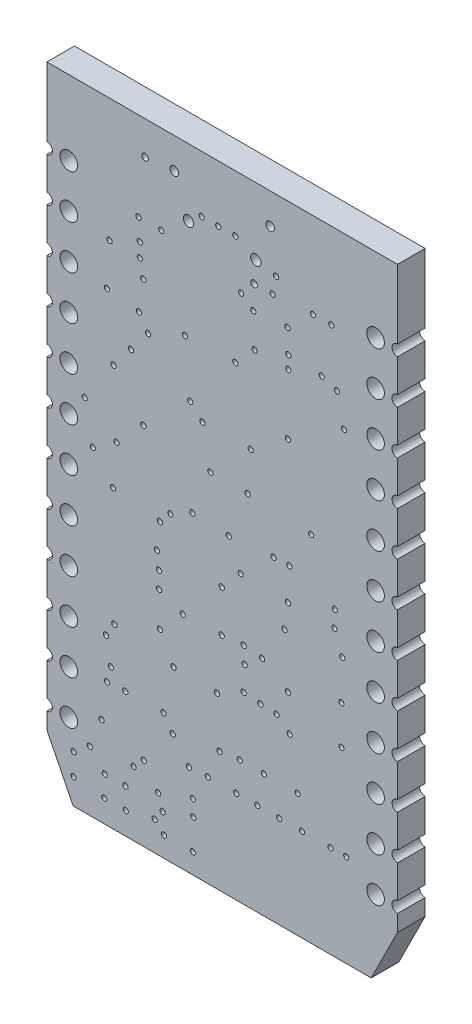
from build123d import *

# Parameters (mm, degrees)
BOARD_OUTLINE_DEPTH = 1.6
SKETCH2_R           = 0.3
SKETCH2_R_2         = 0.1524
SKETCH2_R_3         = 0.15
SKETCH2_R_4         = 0.1905
NPTH_DEPTH          = 42.872021399
SKETCH3_R           = 0.51
SKETCH3_R_2         = 0.32
SKETCH3_R_3         = 0.25
PTH_DEPTH           = 42.872021399


with BuildPart() as part:
    # Sketch1 → Board_Outline (new body)
    with BuildSketch(Plane.XY):
        Polygon((0, 36.576), (0, 3.048), (1.524, 0), (18.796, 0), (20.32, 3.048), (20.32, 36.576), align=None)
    extrude(amount=BOARD_OUTLINE_DEPTH)

    # Sketch2 → NPTH (cut, through all)
    with BuildSketch(Plane.XY):
        with Locations((12.11, 32.698)):
            Circle(SKETCH2_R)
        with Locations((8.21, 32.698)):
            Circle(SKETCH2_R)
        with Locations((13.3096, 10.4902)):
            Circle(SKETCH2_R_2)
        with Locations((17.2212, 26.7462)):
            Circle(SKETCH2_R_2)
        with Locations((4.8768, 24.5872)):
            Circle(SKETCH2_R_2)
        with Locations((16.8142, 28.4788)):
            Circle(SKETCH2_R_2)
        with Locations((9.4742, 20.7264)):
            Circle(SKETCH2_R_2)
        with Locations((13.9954, 28.1432)):
            Circle(SKETCH2_R_2)
        with Locations((11.6332, 20.7264)):
            Circle(SKETCH2_R_2)
        with Locations((10.0076, 6.985)):
            Circle(SKETCH2_R_2)
        with Locations((13.9954, 28.8798)):
            Circle(SKETCH2_R_2)
        with Locations((12.0396, 28.1432)):
            Circle(SKETCH2_R_2)
        with Locations((3.9116, 10.3124)):
            Circle(SKETCH2_R_2)
        with Locations((5.588, 21.1328)):
            Circle(SKETCH2_R_2)
        with Locations((3.429, 9.525)):
            Circle(SKETCH2_R_2)
        with Locations((3.8354, 17.1196)):
            Circle(SKETCH2_R_2)
        with Locations((11.4046, 10.6426)):
            Circle(SKETCH2_R_2)
        with Locations((12.3698, 10.541)):
            Circle(SKETCH2_R_2)
        with Locations((7.874, 12.8016)):
            Circle(SKETCH2_R_2)
        with Locations((6.5532, 16.7894)):
            Circle(SKETCH2_R_2)
        with Locations((10.1346, 15.2908)):
            Circle(SKETCH2_R_2)
        with Locations((11.2268, 16.51)):
            Circle(SKETCH2_R_2)
        with Locations((14.0462, 18.3134)):
            Circle(SKETCH2_R_2)
        with Locations((13.1318, 18.288)):
            Circle(SKETCH2_R_2)
        with Locations((17.1196, 15.2654)):
            Circle(SKETCH2_R_2)
        with Locations((16.6878, 17.4498)):
            Circle(SKETCH2_R_2)
        with Locations((9.8552, 9.8298)):
            Circle(SKETCH2_R_2)
        with Locations((8.4328, 18.161)):
            Circle(SKETCH2_R_2)
        with Locations((2.4892, 3.4798)):
            Circle(SKETCH2_R_3)
        with Locations((1.5494, 1.4732)):
            Circle(SKETCH2_R_3)
        with Locations((8.4582, 1.1684)):
            Circle(SKETCH2_R_3)
        with Locations((6.2484, 1.7018)):
            Circle(SKETCH2_R_3)
        with Locations((14.5288, 7.1374)):
            Circle(SKETCH2_R_3)
        with Locations((4.5466, 2.5146)):
            Circle(SKETCH2_R_3)
        with Locations((1.5494, 2.7432)):
            Circle(SKETCH2_R_3)
        with Locations((9.3218, 5.3594)):
            Circle(SKETCH2_R_3)
        with Locations((16.4338, 5.3594)):
            Circle(SKETCH2_R_3)
        with Locations((13.462, 5.3594)):
            Circle(SKETCH2_R_3)
        with Locations((10.9728, 5.3594)):
            Circle(SKETCH2_R_3)
        with Locations((12.192, 5.3594)):
            Circle(SKETCH2_R_3)
        with Locations((3.7084, 8.0772)):
            Circle(SKETCH2_R_3)
        with Locations((11.2522, 30.607)):
            Circle(SKETCH2_R_3)
        with Locations((5.3848, 29.4386)):
            Circle(SKETCH2_R_3)
        with Locations((5.3848, 30.2514)):
            Circle(SKETCH2_R_2)
        with Locations((3.6322, 29.4386)):
            Circle(SKETCH2_R_2)
        with Locations((8.9662, 33.2994)):
            Circle(SKETCH2_R_2)
        with Locations((13.2842, 32.4612)):
            Circle(SKETCH2_R_2)
        with Locations((13.9446, 30.226)):
            Circle(SKETCH2_R_2)
        with Locations((15.3162, 20.5232)):
            Circle(SKETCH2_R_3)
        with Locations((4.0386, 19.5072)):
            Circle(SKETCH2_R_3)
        with Locations((11.4554, 12.065)):
            Circle(SKETCH2_R_3)
        with Locations((12.4714, 12.8778)):
            Circle(SKETCH2_R_3)
        with Locations((3.4798, 26.9494)):
            Circle(SKETCH2_R_3)
        with Locations((17.0688, 10.7188)):
            Circle(SKETCH2_R_3)
        with Locations((9.017, 23.0124)):
            Circle(SKETCH2_R_3)
        with Locations((17.3482, 5.3594)):
            Circle(SKETCH2_R_3)
        with Locations((3.4798, 7.2136)):
            Circle(SKETCH2_R_3)
        with Locations((14.7828, 5.3594)):
            Circle(SKETCH2_R_3)
        with Locations((3.3528, 2.5146)):
            Circle(SKETCH2_R_3)
        with Locations((11.811, 23.0378)):
            Circle(SKETCH2_R_3)
        with Locations((8.001, 26.8478)):
            Circle(SKETCH2_R_3)
        with Locations((13.97, 24.638)):
            Circle(SKETCH2_R_3)
        with Locations((6.6294, 31.4452)):
            Circle(SKETCH2_R_3)
        with Locations((13.081, 31.4706)):
            Circle(SKETCH2_R_2)
        with Locations((11.176, 7.1374)):
            Circle(SKETCH2_R_3)
        with Locations((7.1628, 17.4752)):
            Circle(SKETCH2_R_3)
        with Locations((2.1844, 20.828)):
            Circle(SKETCH2_R_3)
        with Locations((17.0688, 12.954)):
            Circle(SKETCH2_R_3)
        with Locations((11.9634, 30.0736)):
            Circle(SKETCH2_R_3)
        with Locations((8.4582, 3.8354)):
            Circle(SKETCH2_R_3)
        with Locations((4.572, 1.2954)):
            Circle(SKETCH2_R_3)
        with Locations((6.7818, 1.1684)):
            Circle(SKETCH2_R_3)
        with Locations((3.3274, 1.2954)):
            Circle(SKETCH2_R_3)
        with Locations((5.0292, 3.7338)):
            Circle(SKETCH2_R_3)
        with Locations((6.7056, 2.3114)):
            Circle(SKETCH2_R_3)
        with Locations((12.573, 7.1374)):
            Circle(SKETCH2_R_3)
        with Locations((8.4836, 2.921)):
            Circle(SKETCH2_R_3)
        with Locations((5.6134, 4.3434)):
            Circle(SKETCH2_R_3)
        with Locations((6.4516, 3.1242)):
            Circle(SKETCH2_R_3)
        with Locations((3.175, 5.1562)):
            Circle(SKETCH2_R_3)
        with Locations((8.2296, 5.3086)):
            Circle(SKETCH2_R_3)
        with Locations((6.7564, 7.2898)):
            Circle(SKETCH2_R_3)
        with Locations((5.334, 26.6954)):
            Circle(SKETCH2_R_2)
        with Locations((9.9314, 33.2994)):
            Circle(SKETCH2_R_2)
        with Locations((5.8674, 25.8826)):
            Circle(SKETCH2_R_2)
        with Locations((10.922, 33.2994)):
            Circle(SKETCH2_R_2)
        with Locations((5.3086, 31.4452)):
            Circle(SKETCH2_R_2)
        with Locations((5.588, 28.4734)):
            Circle(SKETCH2_R_2)
        with Locations((15.4178, 31.623)):
            Circle(SKETCH2_R_2)
        with Locations((10.922, 26.9494)):
            Circle(SKETCH2_R_2)
        with Locations((3.8608, 23.2918)):
            Circle(SKETCH2_R_2)
        with Locations((8.3058, 23.6982)):
            Circle(SKETCH2_R_2)
        with Locations((4.5466, 7.2644)):
            Circle(SKETCH2_R_2)
        with Locations((7.3406, 9.8806)):
            Circle(SKETCH2_R_2)
        with Locations((7.2898, 6.5024)):
            Circle(SKETCH2_R_2)
        with Locations((6.5532, 11.3792)):
            Circle(SKETCH2_R_2)
        with Locations((6.3754, 15.2654)):
            Circle(SKETCH2_R_2)
        with Locations((11.4046, 13.0048)):
            Circle(SKETCH2_R_2)
        with Locations((16.4846, 31.623)):
            Circle(SKETCH2_R_2)
        with Locations((6.4968, 14.32)):
            Circle(SKETCH2_R_2)
        with Locations((10.1346, 12.8778)):
            Circle(SKETCH2_R_2)
        with Locations((15.9258, 28.7782)):
            Circle(SKETCH2_R_2)
        with Locations((6.5024, 13.3604)):
            Circle(SKETCH2_R_2)
        with Locations((2.667, 18.5674)):
            Circle(SKETCH2_R_2)
        with Locations((13.97, 16.4338)):
            Circle(SKETCH2_R_2)
        with Locations((10.541, 18.0594)):
            Circle(SKETCH2_R_2)
        with Locations((5.6896, 34.6456)):
            Circle(SKETCH2_R_4)
        with Locations((12.0142, 31.4452)):
            Circle(SKETCH2_R_4)
        with Locations((16.6624, 16.4846)):
            Circle(SKETCH2_R_2)
        with Locations((14.0716, 9.8806)):
            Circle(SKETCH2_R_2)
        with Locations((13.97, 11.938)):
            Circle(SKETCH2_R_2)
        with Locations((13.7668, 14.986)):
            Circle(SKETCH2_R_2)
    extrude(amount=NPTH_DEPTH, mode=Mode.SUBTRACT)

    # Sketch3 → PTH (cut, through all)
    with BuildSketch(Plane.XY):
        with Locations((1.27, 4.32)):
            Circle(SKETCH3_R)
        with Locations((1.27, 6.86)):
            Circle(SKETCH3_R)
        with Locations((1.27, 9.4)):
            Circle(SKETCH3_R)
        with Locations((1.27, 11.94)):
            Circle(SKETCH3_R)
        with Locations((1.27, 14.48)):
            Circle(SKETCH3_R)
        with Locations((1.27, 17.02)):
            Circle(SKETCH3_R)
        with Locations((1.27, 19.56)):
            Circle(SKETCH3_R)
        with Locations((1.27, 22.1)):
            Circle(SKETCH3_R)
        with Locations((1.27, 24.64)):
            Circle(SKETCH3_R)
        with Locations((1.27, 27.18)):
            Circle(SKETCH3_R)
        with Locations((1.27, 29.72)):
            Circle(SKETCH3_R)
        with Locations((1.27, 32.26)):
            Circle(SKETCH3_R)
        with Locations((0, 4.32)):
            Circle(SKETCH3_R_2)
        with Locations((0, 6.86)):
            Circle(SKETCH3_R_2)
        with Locations((0, 9.4)):
            Circle(SKETCH3_R_2)
        with Locations((0, 11.94)):
            Circle(SKETCH3_R_2)
        with Locations((0, 14.48)):
            Circle(SKETCH3_R_2)
        with Locations((0, 17.02)):
            Circle(SKETCH3_R_2)
        with Locations((0, 19.56)):
            Circle(SKETCH3_R_2)
        with Locations((0, 22.1)):
            Circle(SKETCH3_R_2)
        with Locations((0, 24.64)):
            Circle(SKETCH3_R_2)
        with Locations((0, 27.18)):
            Circle(SKETCH3_R_2)
        with Locations((0, 29.72)):
            Circle(SKETCH3_R_2)
        with Locations((0, 32.26)):
            Circle(SKETCH3_R_2)
        with Locations((19.05, 32.26)):
            Circle(SKETCH3_R)
        with Locations((19.05, 29.72)):
            Circle(SKETCH3_R)
        with Locations((19.05, 27.18)):
            Circle(SKETCH3_R)
        with Locations((19.05, 24.64)):
            Circle(SKETCH3_R)
        with Locations((19.05, 22.1)):
            Circle(SKETCH3_R)
        with Locations((19.05, 19.56)):
            Circle(SKETCH3_R)
        with Locations((19.05, 17.02)):
            Circle(SKETCH3_R)
        with Locations((19.05, 14.48)):
            Circle(SKETCH3_R)
        with Locations((19.05, 11.94)):
            Circle(SKETCH3_R)
        with Locations((19.05, 9.4)):
            Circle(SKETCH3_R)
        with Locations((19.05, 6.86)):
            Circle(SKETCH3_R)
        with Locations((19.05, 4.32)):
            Circle(SKETCH3_R)
        with Locations((20.32, 32.26)):
            Circle(SKETCH3_R_2)
        with Locations((20.32, 29.72)):
            Circle(SKETCH3_R_2)
        with Locations((20.32, 27.18)):
            Circle(SKETCH3_R_2)
        with Locations((20.32, 24.64)):
            Circle(SKETCH3_R_2)
        with Locations((20.32, 22.1)):
            Circle(SKETCH3_R_2)
        with Locations((20.32, 19.56)):
            Circle(SKETCH3_R_2)
        with Locations((20.32, 17.02)):
            Circle(SKETCH3_R_2)
        with Locations((20.32, 14.48)):
            Circle(SKETCH3_R_2)
        with Locations((20.32, 11.94)):
            Circle(SKETCH3_R_2)
        with Locations((20.32, 9.4)):
            Circle(SKETCH3_R_2)
        with Locations((20.32, 6.86)):
            Circle(SKETCH3_R_2)
        with Locations((20.32, 4.32)):
            Circle(SKETCH3_R_2)
        with Locations((12.94, 34.8)):
            Circle(SKETCH3_R_3)
        with Locations((7.39, 34.8)):
            Circle(SKETCH3_R_3)
    extrude(amount=PTH_DEPTH, mode=Mode.SUBTRACT)


solid = part.part
